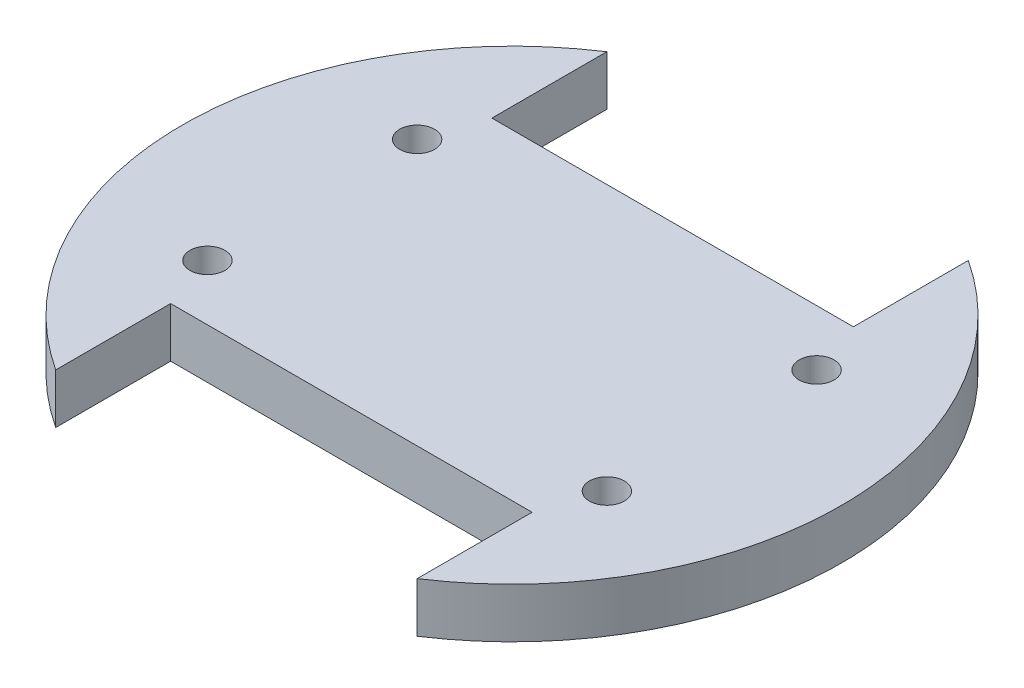
from build123d import *

# Parameters (mm, degrees)
SKETCH_1_R          = 33
EXTRUDE_1_DEPTH     = 5
SKETCH_2_W          = 36.199345992
SKETCH_2_H          = 28.904450881
CUT_EXTRUDE_2_DEPTH = 47.936126811
SKETCH_4_R          = 1.75
CUT_EXTRUDE_3_DEPTH = 44.30590996


with BuildPart() as part:
    # 草图1 → 凸台-拉伸1 (new body)
    with BuildSketch(Plane(origin=(0, 0, 0), x_dir=(1, 0, 0), z_dir=(0, 1, 0))):
        with Locations(Location((0, 0, 0), (0, 0, 270))):
            Circle(SKETCH_1_R)
    extrude(amount=EXTRUDE_1_DEPTH)

    # 草图2 → 切除-拉伸2 (cut, through all)
    with BuildSketch(Plane(origin=(0, 5, 0), x_dir=(1, 0, 0), z_dir=(0, 1, 0))):
        with Locations((0, -30.536922901)):
            Rectangle(SKETCH_2_W, SKETCH_2_H)
        with Locations((0, 30.536922901)):
            Rectangle(SKETCH_2_W, SKETCH_2_H)
    extrude(amount=-CUT_EXTRUDE_2_DEPTH, mode=Mode.SUBTRACT)

    # 草图4 → 切除-拉伸3 (cut, through all)
    with BuildSketch(Plane(origin=(0, 5, 0), x_dir=(1, 0, 0), z_dir=(0, 1, 0))):
        with Locations(Location((-20, 10.5, 0), (0, 0, 270))):
            Circle(SKETCH_4_R)
        with Locations(Location((20, 10.5, 0), (0, 0, 270))):
            Circle(SKETCH_4_R)
        with Locations(Location((-20, -10.5, 0), (0, 0, 270))):
            Circle(SKETCH_4_R)
        with Locations(Location((20, -10.5, 0), (0, 0, 270))):
            Circle(SKETCH_4_R)
    extrude(amount=-CUT_EXTRUDE_3_DEPTH, mode=Mode.SUBTRACT)


solid = part.part
